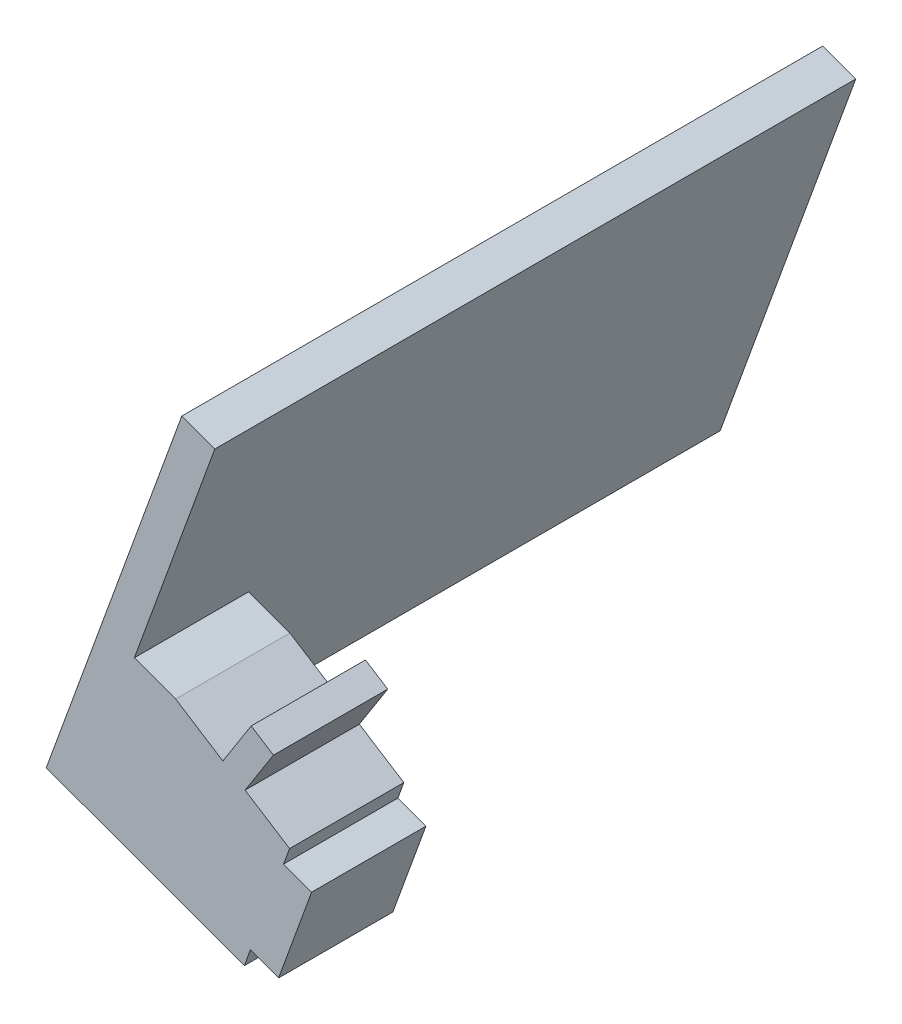
from build123d import *

# Parameters (mm, degrees)
SKETCH1_W      = 203.2
SKETCH1_H      = 101.6
EXTRUDE1_DEPTH = 50.8
EXTRUDE2_DEPTH = 16.51
SKETCH23_W     = 203.2
SKETCH23_H     = 50.8
EXTRUDE3_DEPTH = 508
SKETCH24_W     = 16.51
SKETCH24_H     = 23.273283323
EXTRUDE6_DEPTH = 5.08


with BuildPart() as part:
    # Sketch1 → Extrude1 (new body)
    with BuildSketch(Plane.XY):
        with Locations((101.6, 50.8)):
            Rectangle(SKETCH1_W, SKETCH1_H)
    extrude(amount=EXTRUDE1_DEPTH)

    # Sketch21 → Extrude2 (add)
    with BuildSketch(Plane.XY.offset(50.8)):
        Polygon((10.680914086, 39.466921448), (16.647962228, 37.295093538), (23.464694461, 32.952356157), (27.558917476, 39.378998974), (30.772238885, 37.331887466), (26.678015869, 30.905244649), (33.104658686, 26.811021633), (32.238976379, 24.432579042), (36.293520259, 22.947359397), (31.515498857, 9.819853485), (27.43078785, 11.306566707), (26.589174956, 8.909877207), (2.720982388, 17.597188848), align=None)
    extrude(amount=EXTRUDE2_DEPTH)

    # Sketch23 → Extrude3 (cut)
    with BuildSketch(Plane.XZ):
        with Locations((101.6, 25.4)):
            Rectangle(SKETCH23_W, SKETCH23_H)
    extrude(amount=-EXTRUDE3_DEPTH, mode=Mode.SUBTRACT)

    # Sketch24 → Extrude6 (add)
    with BuildSketch(Plane(origin=(-3.252939565, 1.183973176, 0), x_dir=(0, 0, 1), z_dir=(-0.9396926207859065, 0.3420201433256742, 0))):
        Polygon((-25.295320048, 17.466579293), (50.8, 17.466579293), (50.8, 40.739862616), (67.31, 40.739862616), (67.31, 74.721559979), (50.8, 74.721559979), (-25.295320048, 74.721559979), align=None)
        with Locations((59.055, 29.103220955)):
            Rectangle(SKETCH24_W, SKETCH24_H)
    extrude(amount=EXTRUDE6_DEPTH)


solid = part.part
